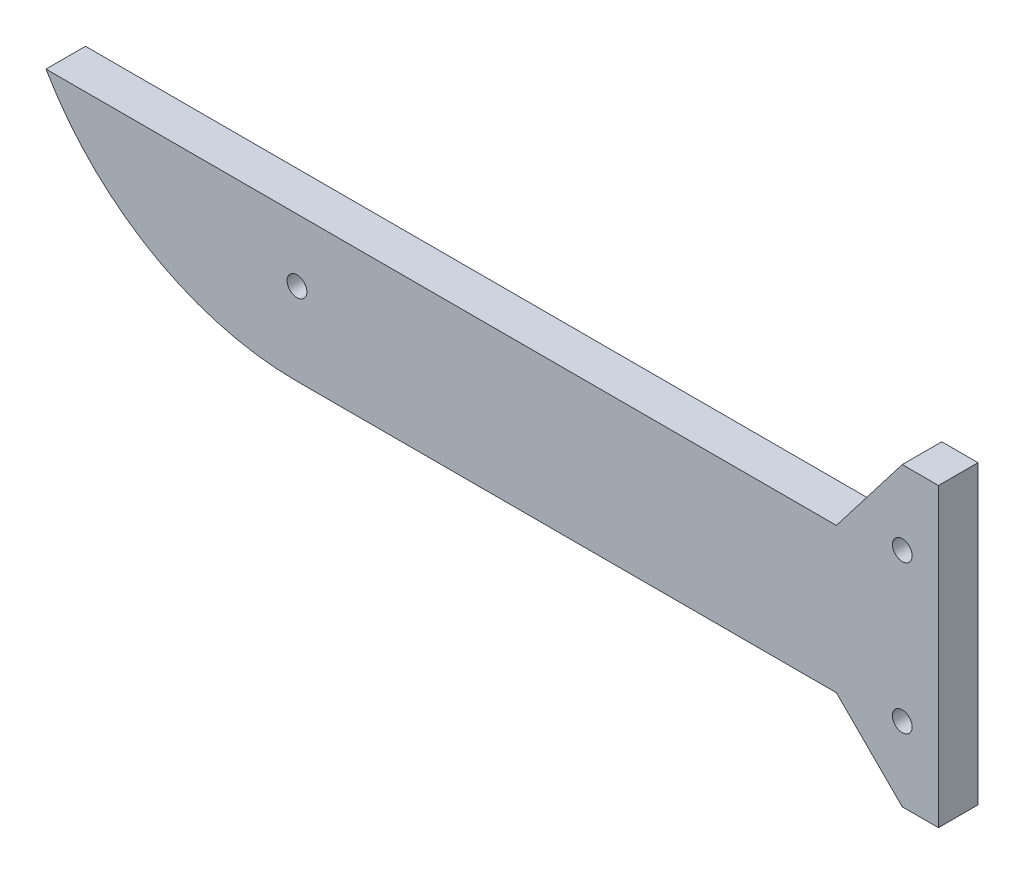
from build123d import *

# Parameters (mm, degrees)
SKETCH1_R           = 1.5
BOSS_EXTRUDE1_DEPTH = 6


with BuildPart() as part:
    # Sketch1 → Boss-Extrude1 (new body)
    with BuildSketch(Plane.XY):
        with BuildLine():
            Line((0, -3), (120, -3))
            Line((120, -3), (130, 10))
            Line((130, 10), (135.5, 10))
            Line((135.5, 10), (135.5, -35))
            Line((135.5, -35), (130, -35))
            Line((130, -35), (120, -25))
            Line((120, -25), (38.105117767, -25))
            ThreePointArc((38.105117767, -25), (16.105117767, -19.105117767), (0, -3))
        make_face()
        with Locations((130, -1.25)):
            Circle(SKETCH1_R, mode=Mode.SUBTRACT)
        with Locations((130, -23.75)):
            Circle(SKETCH1_R, mode=Mode.SUBTRACT)
        with Locations((38.105117767, -12.5)):
            Circle(SKETCH1_R, mode=Mode.SUBTRACT)
    extrude(amount=BOSS_EXTRUDE1_DEPTH)


solid = part.part
